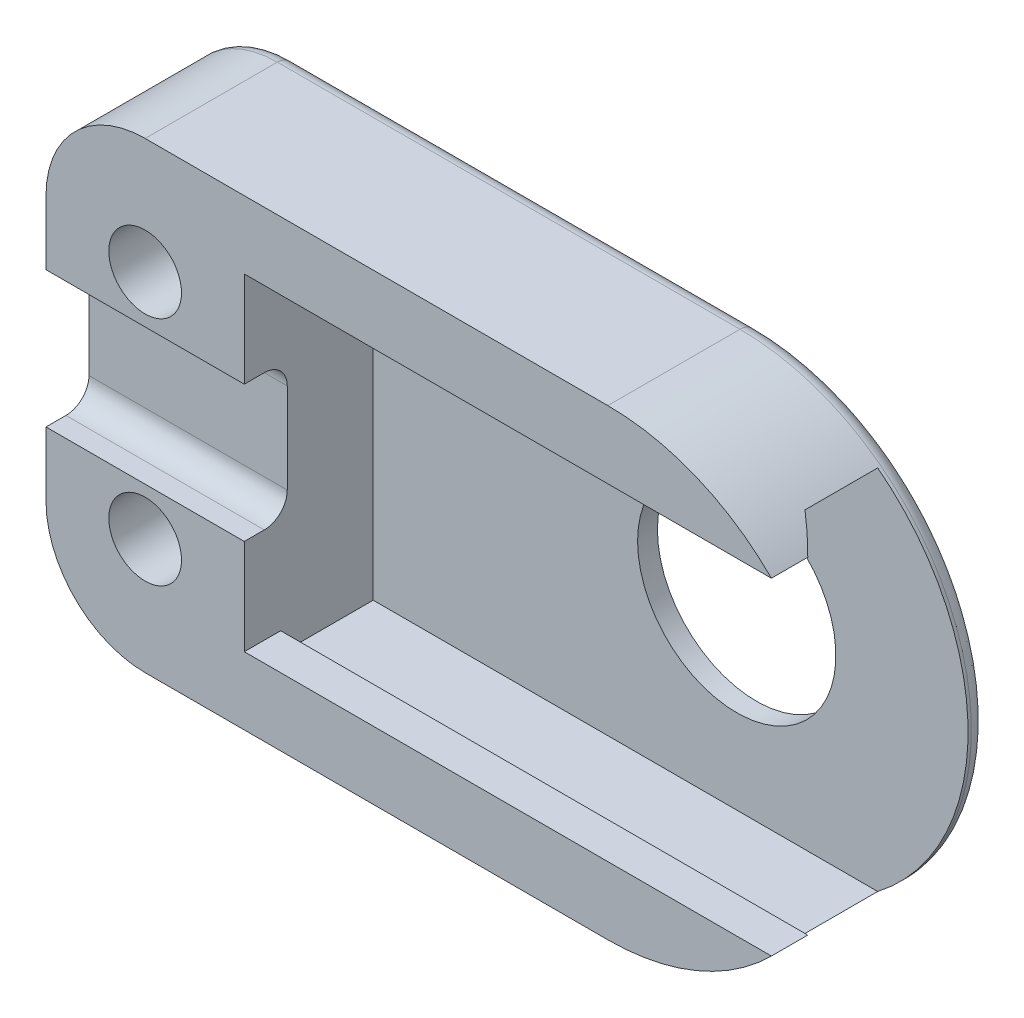
from build123d import *

# Parameters (mm, degrees)
SKETCH1_R           = 1.1
BOSS_EXTRUDE1_DEPTH = 4.5
SKETCH2_R           = 3
CUT_EXTRUDE2_DEPTH  = 10
CUT_EXTRUDE4_START  = -6
CUT_EXTRUDE4_DEPTH  = 20.401771592
CUT_EXTRUDE6_DEPTH  = 26.401771592
FILLET4_R           = 3
FILLET1_R           = 0.5
SKETCH5_R           = 1.75
CUT_EXTRUDE5_DEPTH  = 1


with BuildPart() as part:
    # Sketch1 → Boss-Extrude1 (new body)
    with BuildSketch(Plane.XY):
        with BuildLine():
            Line((-17, 7), (0, 7))
            ThreePointArc((0, 7), (7, 0), (0, -7))
            Line((0, -7), (-17, -7))
            Line((-17, -7), (-17, 7))
        make_face()
        with Locations((-14, 3.5)):
            Circle(SKETCH1_R, mode=Mode.SUBTRACT)
        with Locations(Location((-14, -3.5, 0), (0, 0, 180))):
            Circle(SKETCH1_R, mode=Mode.SUBTRACT)
    extrude(amount=BOSS_EXTRUDE1_DEPTH)

    # Sketch2 → Cut-Extrude2 (cut)
    with BuildSketch(Plane(origin=(0, 0, 0), x_dir=(-1, 0, 0), z_dir=(0, 0, -1))):
        Circle(SKETCH2_R)
    extrude(amount=-CUT_EXTRUDE2_DEPTH, mode=Mode.SUBTRACT)

    # Sketch7 → Cut-Extrude4 (cut, through all)
    with BuildSketch(Plane.ZY.offset(17).offset(CUT_EXTRUDE4_START)):
        Polygon((2.8, 5.55), (0.6, 5.55), (0.6, 0), (4.5, 0), (4.5, 4.95), (3.4, 4.95), align=None)
        Polygon((4.5, 0), (0.6, 0), (0.6, -5.55), (2.8, -5.55), (3.4, -4.95), (4.5, -4.95), align=None)
    extrude(amount=-CUT_EXTRUDE4_DEPTH, mode=Mode.SUBTRACT)

    # Sketch8 → Cut-Extrude6 (cut, through all)
    with BuildSketch(Plane.ZY.offset(17)):
        with BuildLine():
            Line((3.2, 1.363340016), (3.2, -1.363340016))
            ThreePointArc((3.2, -1.363340016), (3.404046985, -1.855953015), (3.896659984, -2.06))
            Line((3.896659984, -2.06), (4.5, -2.06))
            Line((4.5, -2.06), (4.5, 2.06))
            Line((4.5, 2.06), (3.896659984, 2.06))
            ThreePointArc((3.896659984, 2.06), (3.404046985, 1.855953015), (3.2, 1.363340016))
        make_face()
    extrude(amount=-CUT_EXTRUDE6_DEPTH, mode=Mode.SUBTRACT)

    # Fillet4
    fillet4_edges = [part.edges().sort_by_distance(p)[0] for p in [
        (-17, -7, 2.25),
        (-17, 7, 2.25),
    ]]
    fillet(fillet4_edges, radius=FILLET4_R)

    # Fillet1
    fillet1_edges = [part.edges().sort_by_distance(p)[0] for p in [
        (-7, 7, 0),
        (7, 0, 0),
        (-17, 0, 0),
        (-7, -7, 0),
        (-16.121320344, -6.121320344, 0),
        (-16.121320344, 6.121320344, 0),
    ]]
    fillet(fillet1_edges, radius=FILLET1_R)

    # Sketch5 → Cut-Extrude5 (cut)
    with BuildSketch(Plane.XY):
        with Locations((-14, 3.5)):
            Circle(SKETCH5_R)
        with Locations((-14, -3.5)):
            Circle(SKETCH5_R)
    extrude(amount=CUT_EXTRUDE5_DEPTH, mode=Mode.SUBTRACT)


solid = part.part
